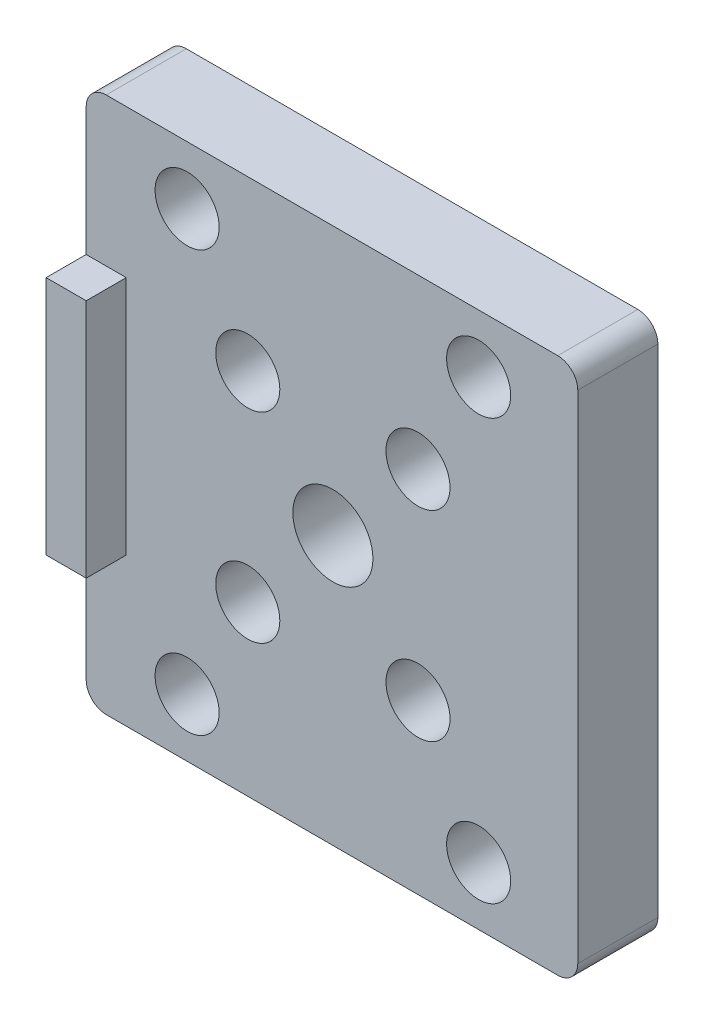
from build123d import *

# Parameters (mm, degrees)
SCHIZZO1_W                   = 24.55
SCHIZZO1_H                   = 26.8
ESTRUSIONE_ESTRUSIONE1_DEPTH = 4
FORO_PER_VITE_M3_1_D         = 3.2
FORO_PER_VITE_M3_2_D         = 3.2
SCHIZZO5_R                   = 2
TAGLIO_ESTRUSIONE1_DEPTH     = 10
SCHIZZO6_W                   = 2
SCHIZZO6_H                   = 12
ESTRUSIONE_ESTRUSIONE2_DEPTH = 2
RACCORDO1_R                  = 1


with BuildPart() as part:
    # Schizzo1 → Estrusione-Estrusione1 (new body)
    with BuildSketch(Plane.XY):
        Rectangle(SCHIZZO1_W, SCHIZZO1_H)
    extrude(amount=ESTRUSIONE_ESTRUSIONE1_DEPTH)

    # Foro per Vite M3-1 (through all)
    with Locations(Plane.XY.offset(4)):
        with Locations((-4.205, 5), (4.295, 5), (4.295, -5), (-4.205, -5)):
            Hole(FORO_PER_VITE_M3_1_D / 2)

    # Foro per Vite M3-2 (through all)
    with Locations(Plane(origin=(-7.235, 10.5, 4), x_dir=(1, 0, 0), z_dir=(0, 0, 1))):
        with Locations((0, 0), (14.56, 0), (0, -21), (14.56, -21)):
            Hole(FORO_PER_VITE_M3_2_D / 2)

    # Schizzo5 → Taglio-Estrusione1 (cut)
    with BuildSketch(Plane.XY.offset(4)):
        with Locations((0.045, 0)):
            Circle(SCHIZZO5_R)
    extrude(amount=-TAGLIO_ESTRUSIONE1_DEPTH, mode=Mode.SUBTRACT)

    # Schizzo6 → Estrusione-Estrusione2 (add)
    with BuildSketch(Plane.XY.offset(4)):
        with Locations((-11.275, 0)):
            Rectangle(SCHIZZO6_W, SCHIZZO6_H)
    extrude(amount=ESTRUSIONE_ESTRUSIONE2_DEPTH)

    # Raccordo1
    raccordo1_edges = [part.edges().sort_by_distance(p)[0] for p in [
        (12.275, -13.4, 2),
        (-12.275, -13.4, 2),
        (-12.275, 13.4, 2),
        (12.275, 13.4, 2),
    ]]
    fillet(raccordo1_edges, radius=RACCORDO1_R)


solid = part.part
